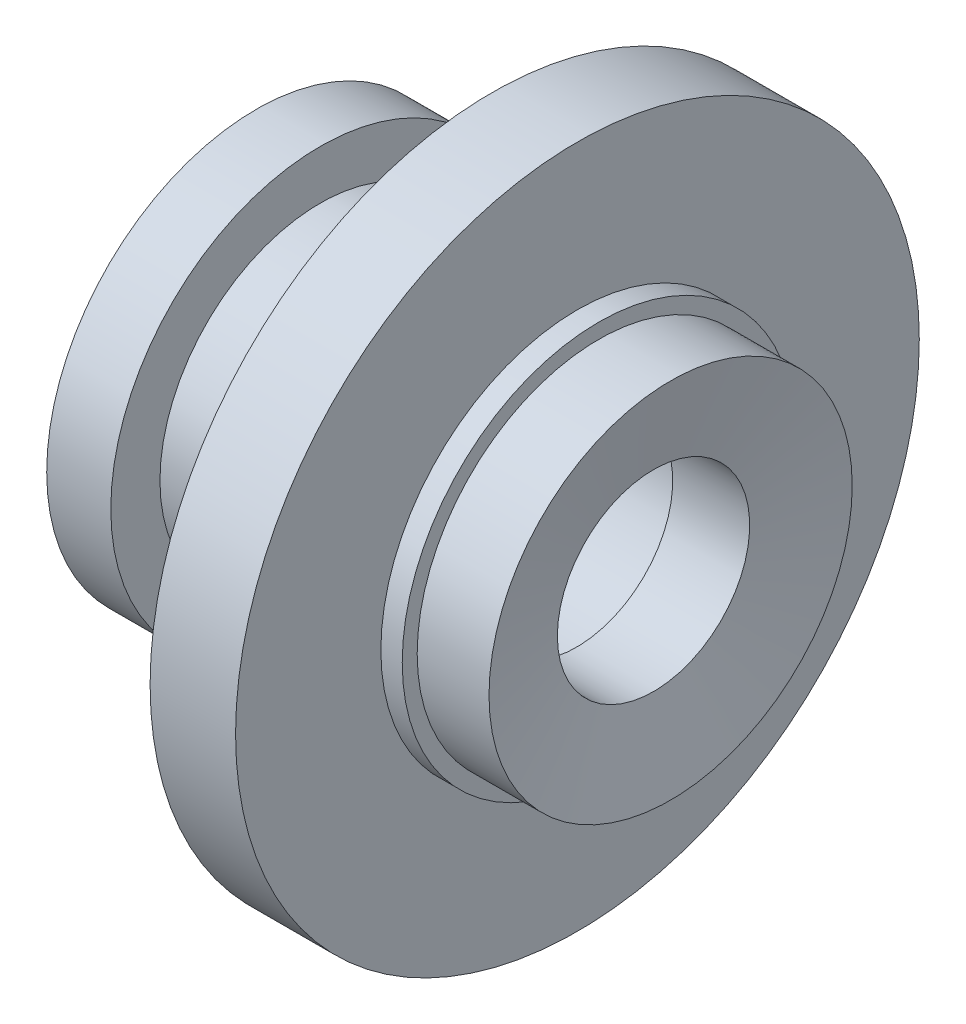
from build123d import *


with BuildPart() as part:
    # Croquis1 → Revolución1 (revolve)
    with BuildSketch(Plane.XY, mode=Mode.PRIVATE) as revoluci_n1_sk:
        Polygon((0, 0), (75, 0), (75, -5), (93, -5), (97, 15), (80.194872218, 15), (80.194872218, 18.5), (75.194872218, 18.5), (75.194872218, 52.5), (55.194872218, 52.5), (55.194872218, 10), (15, 10), (15, 21.5), (0, 21.5), align=None)
    revolve(revoluci_n1_sk.sketch.rotate(Axis((0, -27.5, 0), (1, 0, 0)), 90), axis=Axis((0, -27.5, 0), (1, 0, 0)))


solid = part.part
